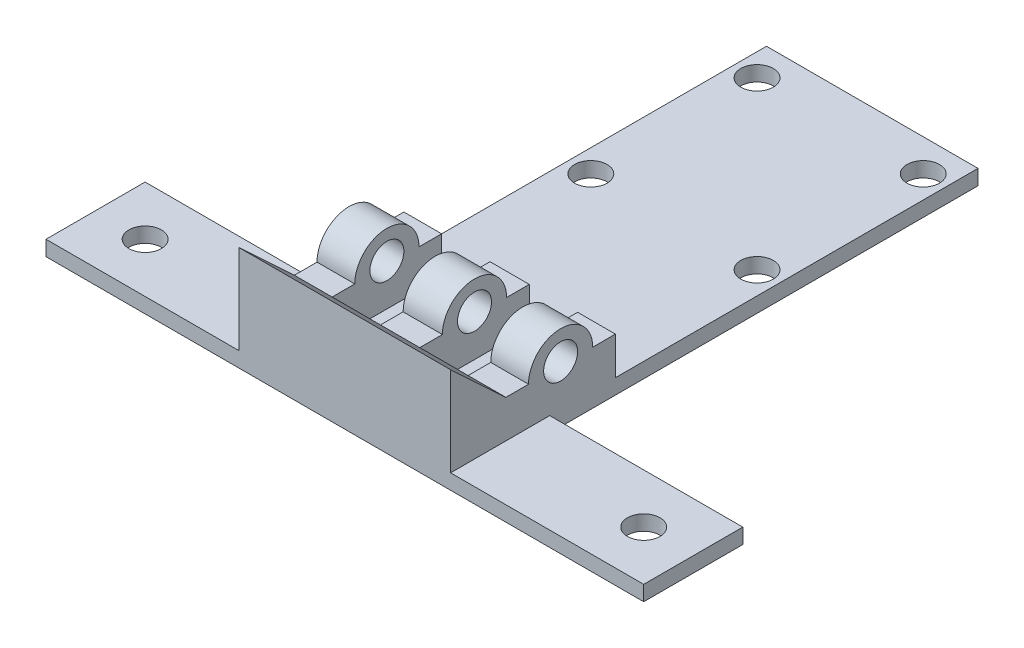
from build123d import *

# Parameters (mm, degrees)
SKETCH1_R                       = 2.25
BOSS_EXTRUDE1_DEPTH             = 14
SKETCH2_W                       = 18
SKETCH2_H                       = 9.25
CUT_EXTRUDE1_DEPTH              = 24.849790355
BOSS_EXTRUDE2_DEPTH             = 2.6
BOSS_EXTRUDE2_DEPTH_BACK        = 2.6
SKETCH4_R                       = 2.25
BOSS_EXTRUDE3_DEPTH             = 28
SKETCH7_W                       = 4.5
SKETCH7_H                       = 3
CUT_EXTRUDE2_DEPTH              = 36.082738034
SKETCH9_W                       = 28
SKETCH9_H                       = 2
BOSS_EXTRUDE4_DEPTH             = 48
BOSS_EXTRUDE5_REACH             = 60.209
SKETCH11_W                      = 28
SKETCH11_H                      = 7.313537016
BOSS_EXTRUDE5_DIRECTION_2_REACH = 60.209
SKETCH14_R                      = 2.15
CUT_EXTRUDE6_DEPTH              = 59.208886884
SKETCH15_W                      = 21.813537016
SKETCH15_H                      = 2
BOSS_EXTRUDE6_DEPTH             = 30
CUT_EXTRUDE7_DEPTH              = 2
SKETCH17_W                      = 21.813537016
SKETCH17_H                      = 2
BOSS_EXTRUDE7_DEPTH             = 30
SKETCH19_R                      = 2.15
CUT_EXTRUDE8_DEPTH              = 2
SKETCH20_W                      = 4.44
SKETCH20_H                      = 13.119449404
SKETCH20_W_2                    = 30
SKETCH20_H_2                    = 8.694087612
CUT_EXTRUDE9_DEPTH              = 2


with BuildPart() as part:
    # Sketch1 → Boss-Extrude1 (new, symmetric)
    with BuildSketch(Plane(origin=(0, 0, 0), x_dir=(0, 0, -1), z_dir=(1, 0, 0))):
        with BuildLine():
            Line((2.25, 1.5), (7.25, 1.5))
            Line((7.25, 1.5), (7.25, 8.5))
            Line((7.25, 8.5), (4.25, 8.5))
            ThreePointArc((4.25, 8.5), (0, 12.75), (-4.25, 8.5))
            Line((-4.25, 8.5), (-7.25, 8.5))
            Line((-7.25, 8.5), (-7.25, 1.5))
            Line((-7.25, 1.5), (-2.25, 1.5))
            Line((-2.25, 1.5), (-2.25, -1.5))
            Line((-2.25, -1.5), (2.25, -1.5))
            Line((2.25, -1.5), (2.25, 1.5))
        make_face()
        with Locations((0, 9)):
            Circle(SKETCH1_R, mode=Mode.SUBTRACT)
    extrude(amount=BOSS_EXTRUDE1_DEPTH, both=True)

    # Sketch2 → Cut-Extrude1 (cut, through all)
    with BuildSketch(Plane.XY.offset(7.25)):
        with Locations((0, 8.125)):
            Rectangle(SKETCH2_W, SKETCH2_H)
    extrude(amount=-CUT_EXTRUDE1_DEPTH, mode=Mode.SUBTRACT)

    # Sketch4 → Boss-Extrude2 (add, two sides: drawn at the far end of the back side and taken through both)
    with BuildSketch(Plane(origin=(0, 0, 0), x_dir=(0, 0, -1), z_dir=(1, 0, 0)).offset(-BOSS_EXTRUDE2_DEPTH_BACK)):
        with BuildLine():
            Line((-4.25, 8.5), (-7.25, 8.5))
            Line((-7.25, 8.5), (-7.25, 3.5))
            Line((-7.25, 3.5), (7.25, 3.5))
            Line((7.25, 3.5), (7.25, 8.5))
            Line((7.25, 8.5), (4.25, 8.5))
            ThreePointArc((4.25, 8.5), (0, 12.75), (-4.25, 8.5))
        make_face()
        with Locations(Location((0, 9, 0), (0, 0, 180))):
            Circle(SKETCH4_R, mode=Mode.SUBTRACT)
    extrude(amount=BOSS_EXTRUDE2_DEPTH + BOSS_EXTRUDE2_DEPTH_BACK)

    # Sketch6 → Boss-Extrude3 (add, through all)
    with BuildSketch(Plane.ZY.offset(14)):
        Polygon((7.25, 8.5), (14.563537016, 15.319983601), (14.563537016, 8.319983601), (7.25, 1.5), align=None)
    extrude(amount=-BOSS_EXTRUDE3_DEPTH)

    # Sketch7 → Cut-Extrude2 (cut, through all)
    with BuildSketch(Plane.ZY.offset(14)):
        Rectangle(SKETCH7_W, SKETCH7_H)
    extrude(amount=-CUT_EXTRUDE2_DEPTH, mode=Mode.SUBTRACT)

    # Sketch9 → Boss-Extrude4 (add)
    with BuildSketch(Plane(origin=(0, 0, -7.25), x_dir=(-1, 0, 0), z_dir=(0, 0, -1))):
        with Locations((0, 2.5)):
            Rectangle(SKETCH9_W, SKETCH9_H)
    extrude(amount=BOSS_EXTRUDE4_DEPTH)

    # Boss-Extrude5: up to this face of the body (flat: up to its plane)
    boss_extrude5_end = Plane(part.part.faces().sort_by_distance((0, 1.5, -24))[0])
    # Sketch11 → Boss-Extrude5 (add, up to the picked face)
    with BuildSketch(Plane(origin=(0, 3.5, 0), x_dir=(1, 0, 0), z_dir=(0, 1, 0)), mode=Mode.PRIVATE) as boss_extrude5_sk1:
        with Locations((0, -10.906768508)):
            Rectangle(SKETCH11_W, SKETCH11_H)
    boss_extrude5_tool1 = split(extrude(boss_extrude5_sk1.sketch, amount=-BOSS_EXTRUDE5_REACH, mode=Mode.PRIVATE), bisect_by=boss_extrude5_end, keep=Keep.BOTH, mode=Mode.PRIVATE)
    add(boss_extrude5_tool1.solids().sort_by(Axis((0, 3.5, 10.906769), (0, -1, 0)))[0])

    # Boss-Extrude5 direction 2: up to this face of the body (flat: up to its plane)
    boss_extrude5_direction_2_end = Plane(part.part.faces().sort_by_distance((0, 4.9099918, 10.906768508))[0])
    # Sketch11 → Boss-Extrude5 direction 2 (add, up to the picked face)
    with BuildSketch(Plane(origin=(0, 3.5, 0), x_dir=(1, 0, 0), z_dir=(0, 1, 0)), mode=Mode.PRIVATE) as boss_extrude5_direction_2_sk1:
        with Locations((0, -10.906768508)):
            Rectangle(SKETCH11_W, SKETCH11_H)
    boss_extrude5_direction_2_tool1 = split(extrude(boss_extrude5_direction_2_sk1.sketch, amount=BOSS_EXTRUDE5_DIRECTION_2_REACH, mode=Mode.PRIVATE), bisect_by=boss_extrude5_direction_2_end, keep=Keep.BOTH, mode=Mode.PRIVATE)
    add(boss_extrude5_direction_2_tool1.solids().sort_by(Axis((0, 3.5, 10.906769), (0, 1, 0)))[0])

    # Sketch14 → Cut-Extrude6 (cut, through all)
    with BuildSketch(Plane(origin=(0, 3.5, 0), x_dir=(1, 0, 0), z_dir=(0, 1, 0))):
        with Locations(Location((11, 51, 0), (0, 0, 270))):
            Circle(SKETCH14_R)
        with Locations(Location((11, 29, 0), (0, 0, 270))):
            Circle(SKETCH14_R)
        with Locations(Location((-11, 29, 0), (0, 0, 270))):
            Circle(SKETCH14_R)
        with Locations(Location((-11, 51, 0), (0, 0, 270))):
            Circle(SKETCH14_R)
    extrude(amount=-CUT_EXTRUDE6_DEPTH, mode=Mode.SUBTRACT)

    # Sketch15 → Boss-Extrude6 (add)
    with BuildSketch(Plane(origin=(14, 0, 0), x_dir=(0, 0, -1), z_dir=(1, 0, 0))):
        with Locations((-3.656768508, 2.5)):
            Rectangle(SKETCH15_W, SKETCH15_H)
    extrude(amount=BOSS_EXTRUDE6_DEPTH)

    # Sketch16 → Cut-Extrude7 (cut)
    with BuildSketch(Plane(origin=(0, 3.5, 0), x_dir=(1, 0, 0), z_dir=(0, 1, 0))):
        with BuildLine():
            ThreePointArc((33, -5.854087612), (32.430271679, -5.930947569), (31.901277584, -6.156032133))
            Line((31.901277584, -6.156032133), (33, -8.004087612))
            Line((33, -8.004087612), (33, -5.854087612))
        make_face()
        with BuildLine():
            Line((33, -8.004087612), (31.901277584, -6.156032133))
            ThreePointArc((31.901277584, -6.156032133), (31.936927376, -9.872877755), (35.15, -8.004087612))
            ThreePointArc((35.15, -8.004087612), (34.52027958, -6.483808032), (33, -5.854087612))
            Line((33, -5.854087612), (33, -8.004087612))
        make_face()
    extrude(amount=-CUT_EXTRUDE7_DEPTH, mode=Mode.SUBTRACT)

    # Sketch17 → Boss-Extrude7 (add)
    with BuildSketch(Plane.ZY.offset(14)):
        with Locations((3.656768508, 2.5)):
            Rectangle(SKETCH17_W, SKETCH17_H)
    extrude(amount=BOSS_EXTRUDE7_DEPTH)

    # Sketch19 → Cut-Extrude8 (cut)
    with BuildSketch(Plane(origin=(0, 3.5, 0), x_dir=(1, 0, 0), z_dir=(0, 1, 0))):
        with Locations(Location((-33, -8, 0), (0, 0, 270))):
            Circle(SKETCH19_R)
    extrude(amount=-CUT_EXTRUDE8_DEPTH, mode=Mode.SUBTRACT)

    # Sketch20 → Cut-Extrude9 (cut)
    with BuildSketch(Plane(origin=(0, 3.5, 0), x_dir=(1, 0, 0), z_dir=(0, 1, 0))):
        Polygon((44, 7.25), (14, 7.25), (14, -1.444087612), (39.56, -1.444087612), (44, -1.444087612), align=None)
        with Locations((41.78, -8.003812314)):
            Rectangle(SKETCH20_W, SKETCH20_H)
        with Locations((-29, 2.902956194)):
            Rectangle(SKETCH20_W_2, SKETCH20_H_2)
        with Locations((-41.78, -8.003812314)):
            Rectangle(SKETCH20_W, SKETCH20_H)
    extrude(amount=-CUT_EXTRUDE9_DEPTH, mode=Mode.SUBTRACT)


solid = part.part
